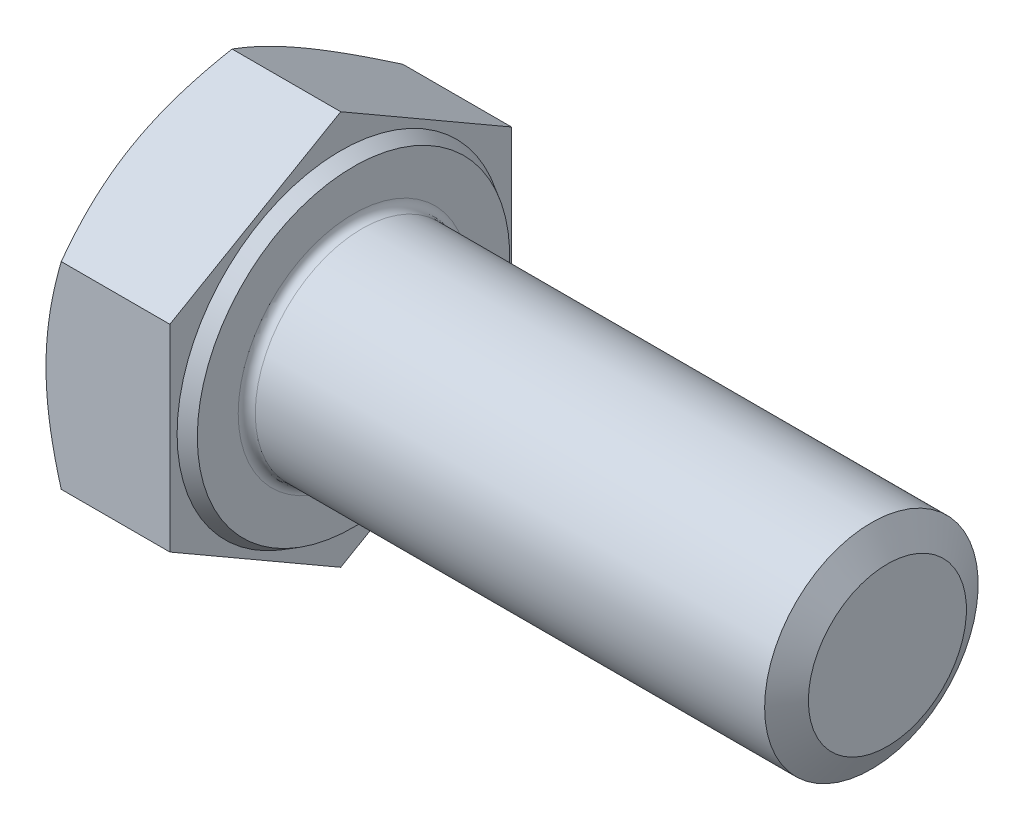
from build123d import *

# Parameters (mm, degrees)
EXTRUDE_388_DEPTH = 6.4
FILLET_1259_R     = 0.4


with BuildPart() as part:
    # 草图1 → Extrude 388 (new body)
    with BuildSketch(Plane(origin=(0, 0, 0), x_dir=(0, 0, -1), z_dir=(1, 0, 0))):
        Polygon((8, 4.618802154), (8, -4.618802154), (0, -9.237604307), (-8, -4.618802154), (-8, 4.618802154), (0, 9.237604307), align=None)
    extrude(amount=EXTRUDE_388_DEPTH)

    # 草图2 → 凸台-旋转1 (revolve)
    with BuildSketch(Plane.XY, mode=Mode.PRIVATE) as revolve_1_sk:
        Polygon((0, 0), (31.4, 0), (31.4, 3.701), (31.4, 5), (0, 5), align=None)
    revolve(revolve_1_sk.sketch.rotate(Axis((0, 0, 0), (1, 0, 0)), 90), axis=Axis((0, 0, 0), (1, 0, 0)))

    # 草图3 → 切除-旋转1 (revolve, cut)
    with BuildSketch(Plane.XY):
        Polygon((0, 8), (3.601282526, 14.237604307), (3.601282526, 19.237604307), (-10, 19.237604307), (-10, 8), align=None)
    revolve(axis=Axis((0, 0, 0), (1, 0, 0)), mode=Mode.SUBTRACT)

    # 草图4 → 切除-旋转3 (revolve, cut)
    with BuildSketch(Plane.XY, mode=Mode.PRIVATE) as cut_revolve_3_sk:
        Polygon((6.4, 7.315), (5.8, 7.661410162), (5.8, 9.237604307), (6.4, 9.237604307), align=None)
    revolve(cut_revolve_3_sk.sketch.rotate(Axis((0, 0, 0), (1, 0, 0)), 90), axis=Axis((0, 0, 0), (1, 0, 0)), mode=Mode.SUBTRACT)

    # Fillet 1259
    fillet_1259_edges = [part.edges().sort_by_distance(p)[0] for p in [
        (6.4, 0, -5),
    ]]
    fillet(fillet_1259_edges, radius=FILLET_1259_R)

    # 草图6 → 切除-旋转4 (revolve, cut)
    with BuildSketch(Plane.XY, mode=Mode.PRIVATE) as cut_revolve_4_sk:
        Polygon((30.65, 5), (32.15, 5), (31.4, 3.700961894), align=None)
    revolve(cut_revolve_4_sk.sketch.rotate(Axis((0, 0, 0), (1, 0, 0)), 90), axis=Axis((0, 0, 0), (1, 0, 0)), mode=Mode.SUBTRACT)


solid = part.part
